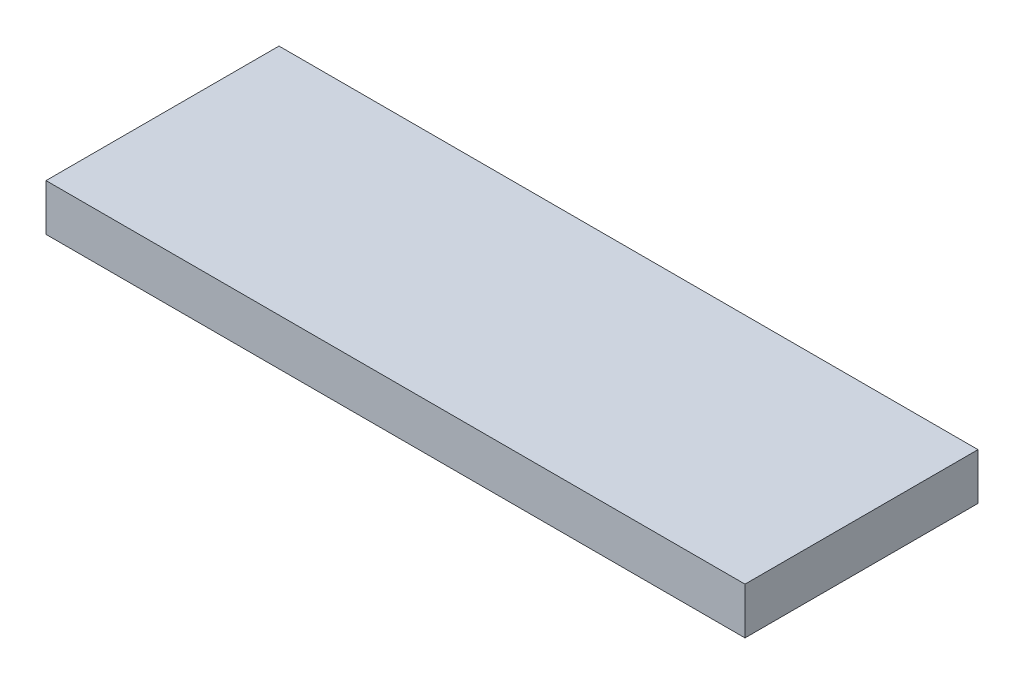
from build123d import *

# Parameters (mm, degrees)
SKETCH1_W           = 38.1
SKETCH1_H           = 12.7
BOSS_EXTRUDE1_DEPTH = 2.54


with BuildPart() as part:
    # Sketch1 → Boss-Extrude1 (new body)
    with BuildSketch(Plane(origin=(0, 0, 0), x_dir=(1, 0, 0), z_dir=(0, 1, 0))):
        with Locations((19.05, 6.35)):
            Rectangle(SKETCH1_W, SKETCH1_H)
    extrude(amount=BOSS_EXTRUDE1_DEPTH)


solid = part.part
